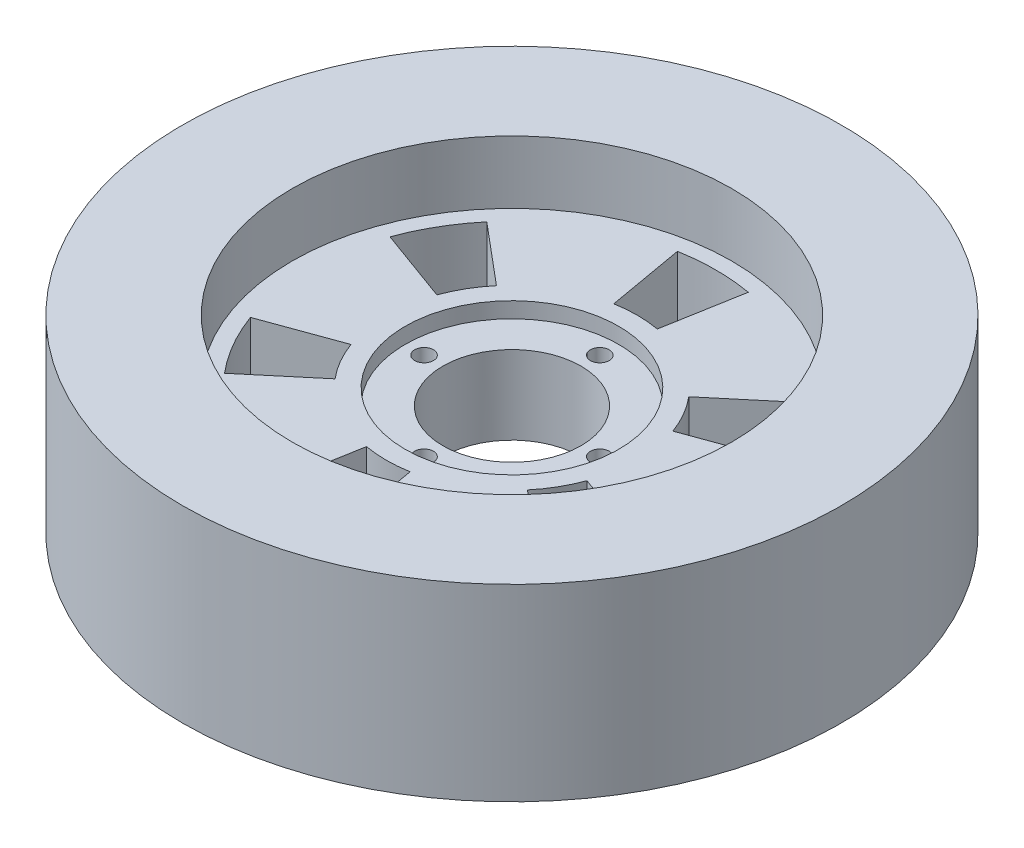
from build123d import *

# Parameters (mm, degrees)
SKETCH_1_R               = 70
EXTRUDE_1_DEPTH          = 10
SKETCH_3_R               = 105
SKETCH_3_R_2             = 70
EXTRUDE_3_DEPTH          = 30
SKETCH_6_R               = 34
EXTRUDE_4_DEPTH          = 10
SKETCH_7_R               = 22
CUT_EXTRUDE_1_DEPTH      = 30
CUT_EXTRUDE_2_DEPTH      = 20
PATTERN_CIRCULAR_1_COUNT = 6
SKETCH_10_R              = 3
CUT_EXTRUDE_4_DEPTH      = 30
PATTERN_CIRCULAR_2_COUNT = 4
SKETCH_15_R              = 34
CUT_EXTRUDE_6_DEPTH      = 5


with BuildPart() as part:
    # 草图1 → 凸台-拉伸1 (new, symmetric)
    with BuildSketch(Plane(origin=(0, 0, 0), x_dir=(1, 0, 0), z_dir=(0, 1, 0))):
        with Locations(Location((0, 0, 0), (0, 0, 270))):
            Circle(SKETCH_1_R)
    extrude(amount=EXTRUDE_1_DEPTH, both=True)

    # 草图3 → 凸台-拉伸3 (add, symmetric)
    with BuildSketch(Plane(origin=(0, 0, 0), x_dir=(1, 0, 0), z_dir=(0, 1, 0))):
        with Locations(Location((0, 0, 0), (0, 0, 270))):
            Circle(SKETCH_3_R)
        with Locations(Location((0, 0, 0), (0, 0, 270))):
            Circle(SKETCH_3_R_2, mode=Mode.SUBTRACT)
    extrude(amount=EXTRUDE_3_DEPTH, both=True)

    # 草图6 → 凸台-拉伸4 (add)
    with BuildSketch(Plane.XZ.offset(10)):
        with Locations(Location((0, 0, 0), (0, 0, 90))):
            Circle(SKETCH_6_R)
    extrude(amount=EXTRUDE_4_DEPTH)

    # 草图7 → 切除-拉伸1 (cut)
    with BuildSketch(Plane.XZ.offset(20)):
        with Locations(Location((0, 0, 0), (0, 0, 270))):
            Circle(SKETCH_7_R)
    extrude(amount=-CUT_EXTRUDE_1_DEPTH, mode=Mode.SUBTRACT)

    # 草图8 → 切除-拉伸2 (cut)
    with BuildSketch(Plane.XZ.offset(10)):
        with BuildLine():
            Line((-6.945927107, 39.39231012), (-11.287131548, 64.012503946))
            ThreePointArc((-11.287131548, 64.012503946), (0, 65), (11.287131548, 64.012503946))
            Line((11.287131548, 64.012503946), (6.945927107, 39.39231012))
            ThreePointArc((6.945927107, 39.39231012), (0, 40), (-6.945927107, 39.39231012))
        make_face()
    cut_extrude_2 = extrude(amount=-CUT_EXTRUDE_2_DEPTH, mode=Mode.SUBTRACT)

    # 阵列(圆周)1: 切除-拉伸2 ×6 about axis
    pattern_circular_1_axis = Axis((0, 0, 0), (0, 1, 0))
    for i in range(1, PATTERN_CIRCULAR_1_COUNT):
        add(cut_extrude_2.rotate(pattern_circular_1_axis, i * 360 / PATTERN_CIRCULAR_1_COUNT), mode=Mode.SUBTRACT)

    # 草图10 → 切除-拉伸4 (cut)
    with BuildSketch(Plane(origin=(0, 10, 0), x_dir=(1, 0, 0), z_dir=(0, 1, 0))):
        with Locations(Location((0, 28, 0), (0, 0, 270))):
            Circle(SKETCH_10_R)
    cut_extrude_4 = extrude(amount=-CUT_EXTRUDE_4_DEPTH, mode=Mode.SUBTRACT)

    # 阵列(圆周)2: 切除-拉伸4 ×4 about axis
    pattern_circular_2_axis = Axis((0, 0, 0), (0, 1, 0))
    for i in range(1, PATTERN_CIRCULAR_2_COUNT):
        add(cut_extrude_4.rotate(pattern_circular_2_axis, i * 360 / PATTERN_CIRCULAR_2_COUNT), mode=Mode.SUBTRACT)

    # 草图15 → 切除-拉伸6 (cut)
    with BuildSketch(Plane(origin=(0, 10, 0), x_dir=(1, 0, 0), z_dir=(0, 1, 0))):
        with Locations(Location((0, 0, 0), (0, 0, 270))):
            Circle(SKETCH_15_R)
    extrude(amount=-CUT_EXTRUDE_6_DEPTH, mode=Mode.SUBTRACT)


solid = part.part
